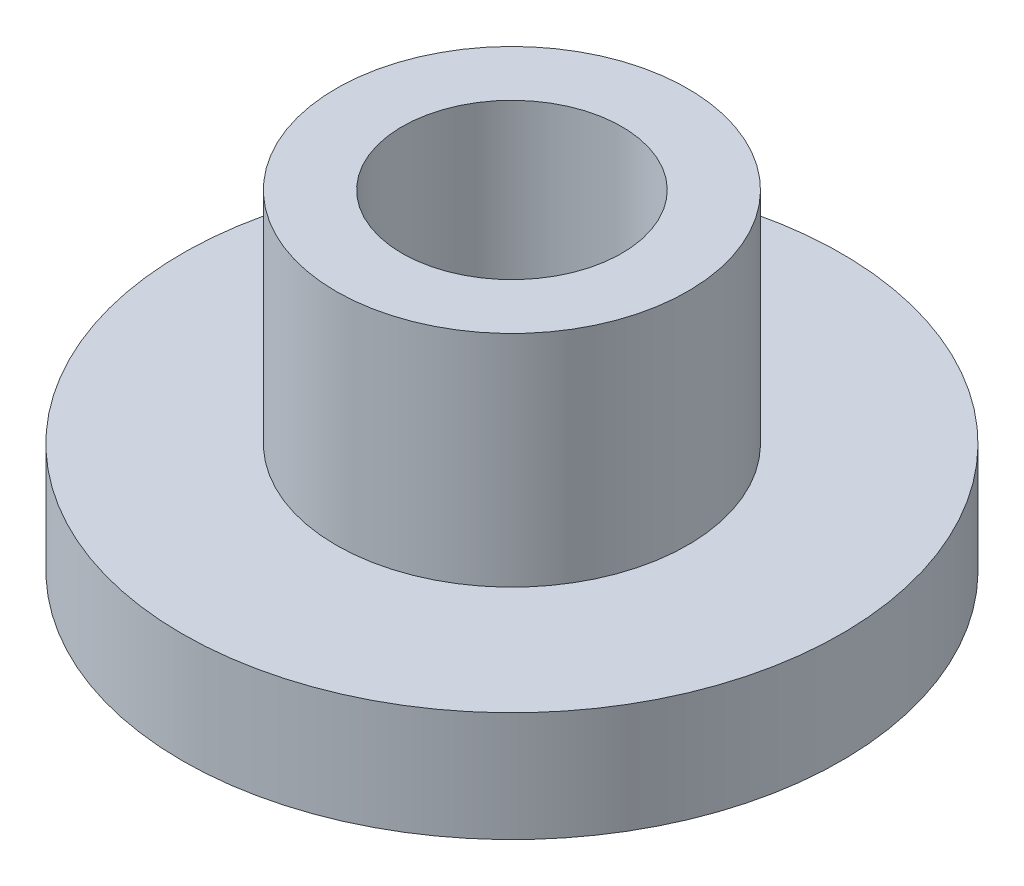
from build123d import *

# Parameters (mm, degrees)
ESQUISSE1_R        = 15
BOSS_EXTRU_1_DEPTH = 5
ESQUISSE2_R        = 8
ESQUISSE2_R_2      = 5
BOSS_EXTRU_2_DEPTH = 10


with BuildPart() as part:
    # Esquisse1 → Boss.-Extru.1 (new body)
    with BuildSketch(Plane(origin=(0, 0, 0), x_dir=(1, 0, 0), z_dir=(0, 1, 0))):
        with Locations(Location((0, 0, 0), (0, 0, 270))):
            Circle(ESQUISSE1_R)
    extrude(amount=BOSS_EXTRU_1_DEPTH)

    # Esquisse2 → Boss.-Extru.2 (add)
    with BuildSketch(Plane(origin=(0, 5, 0), x_dir=(1, 0, 0), z_dir=(0, 1, 0))):
        with Locations(Location((0, 0, 0), (0, 0, 270))):
            Circle(ESQUISSE2_R)
        with Locations(Location((0, 0, 0), (0, 0, 270))):
            Circle(ESQUISSE2_R_2, mode=Mode.SUBTRACT)
    extrude(amount=BOSS_EXTRU_2_DEPTH)


solid = part.part
